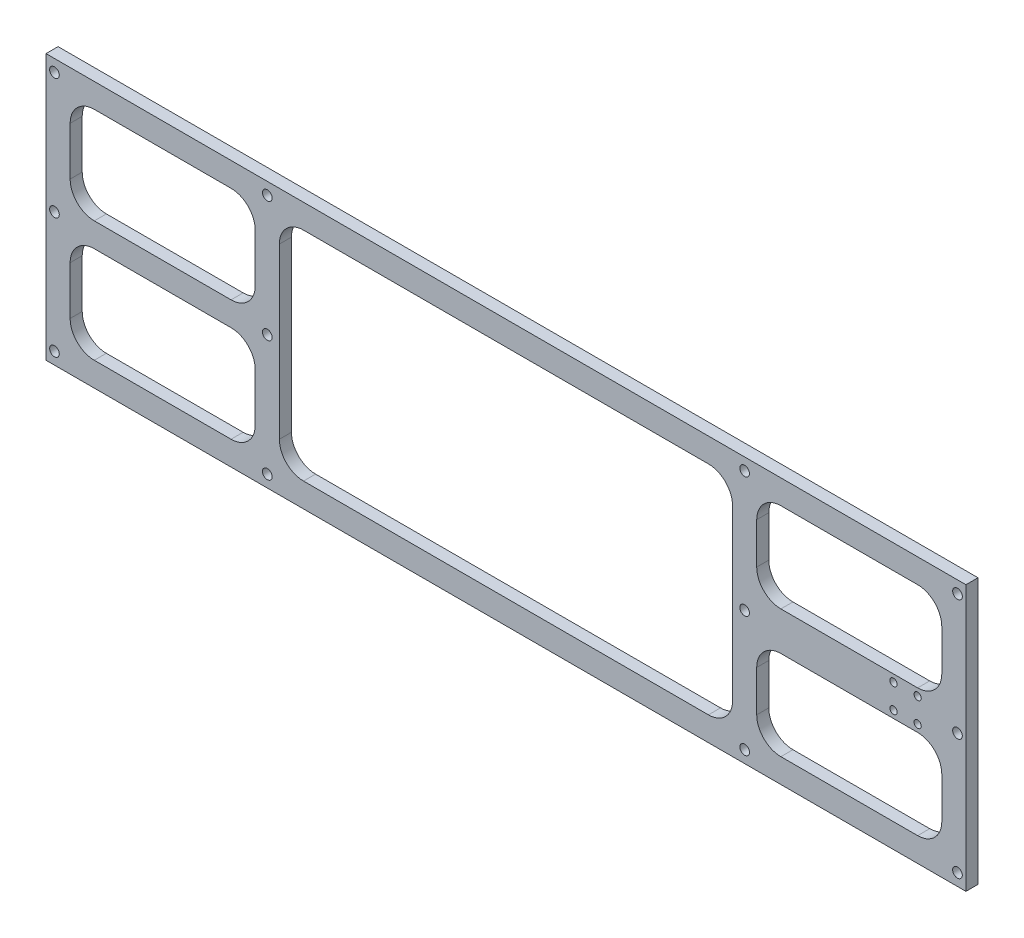
from build123d import *

# Parameters (mm, degrees)
SKETCH_1_W          = 381
SKETCH_1_H          = 110
EXTRUDE_1_DEPTH     = 5
SKETCH_2_R          = 2
CUT_EXTRUDE_1_DEPTH = 5
CUT_EXTRUDE_2_DEPTH = 5
SKETCH_6_R          = 1.5
CUT_EXTRUDE_3_DEPTH = 5
CUT_EXTRUDE_4_DEPTH = 10
FILLET_1_R          = 10


with BuildPart() as part:
    # 草图1 → 凸台-拉伸1 (new body)
    with BuildSketch(Plane.XY):
        with Locations((190.5, 55)):
            Rectangle(SKETCH_1_W, SKETCH_1_H)
    extrude(amount=EXTRUDE_1_DEPTH)

    # 草图2 → 切除-拉伸1 (cut)
    with BuildSketch(Plane.XY.offset(5)):
        with Locations((3.5, 105)):
            Circle(SKETCH_2_R)
        with Locations((3.5, 55)):
            Circle(SKETCH_2_R)
        with Locations((3.5, 5)):
            Circle(SKETCH_2_R)
        with Locations((377.5, 105)):
            Circle(SKETCH_2_R)
        with Locations((377.5, 55)):
            Circle(SKETCH_2_R)
        with Locations((377.5, 5)):
            Circle(SKETCH_2_R)
        with Locations((91.65, 105)):
            Circle(SKETCH_2_R)
        with Locations((91.65, 55)):
            Circle(SKETCH_2_R)
        with Locations((91.65, 5)):
            Circle(SKETCH_2_R)
        with Locations((289.35, 105)):
            Circle(SKETCH_2_R)
        with Locations((289.35, 55)):
            Circle(SKETCH_2_R)
        with Locations((289.35, 5)):
            Circle(SKETCH_2_R)
    extrude(amount=-CUT_EXTRUDE_1_DEPTH, mode=Mode.SUBTRACT)

    # 草图3 → 切除-拉伸2 (cut)
    with BuildSketch(Plane.XY.offset(5)):
        with BuildLine():
            Line((20, 100), (76.65, 100))
            ThreePointArc((76.65, 100), (83.721067812, 97.071067812), (86.65, 90))
            Line((86.65, 90), (86.65, 70))
            ThreePointArc((86.65, 70), (83.721067812, 62.928932188), (76.65, 60))
            Line((76.65, 60), (20, 60))
            ThreePointArc((20, 60), (12.928932188, 62.928932188), (10, 70))
            Line((10, 70), (10, 90))
            ThreePointArc((10, 90), (12.928932188, 97.071067812), (20, 100))
        make_face()
        with BuildLine():
            Line((20, 50), (76.65, 50))
            ThreePointArc((76.65, 50), (83.721067812, 47.071067812), (86.65, 40))
            Line((86.65, 40), (86.65, 20))
            ThreePointArc((86.65, 20), (83.721067812, 12.928932188), (76.65, 10))
            Line((76.65, 10), (20, 10))
            ThreePointArc((20, 10), (12.928932188, 12.928932188), (10, 20))
            Line((10, 20), (10, 40))
            ThreePointArc((10, 40), (12.928932188, 47.071067812), (20, 50))
        make_face()
        with BuildLine():
            Line((106.65, 100), (274.35, 100))
            ThreePointArc((274.35, 100), (281.421067812, 97.071067812), (284.35, 90))
            Line((284.35, 90), (284.35, 70))
            ThreePointArc((284.35, 70), (281.421067812, 62.928932188), (274.35, 60))
            Line((274.35, 60), (106.65, 60))
            ThreePointArc((106.65, 60), (99.578932188, 62.928932188), (96.65, 70))
            Line((96.65, 70), (96.65, 90))
            ThreePointArc((96.65, 90), (99.578932188, 97.071067812), (106.65, 100))
        make_face()
        with BuildLine():
            Line((106.65, 50), (274.35, 50))
            ThreePointArc((274.35, 50), (281.421067812, 47.071067812), (284.35, 40))
            Line((284.35, 40), (284.35, 20))
            ThreePointArc((284.35, 20), (281.421067812, 12.928932188), (274.35, 10))
            Line((274.35, 10), (106.65, 10))
            ThreePointArc((106.65, 10), (99.578932188, 12.928932188), (96.65, 20))
            Line((96.65, 20), (96.65, 40))
            ThreePointArc((96.65, 40), (99.578932188, 47.071067812), (106.65, 50))
        make_face()
        with BuildLine():
            Line((304.35, 100), (361, 100))
            ThreePointArc((361, 100), (368.071067812, 97.071067812), (371, 90))
            Line((371, 90), (371, 73))
            ThreePointArc((371, 73), (368.071067812, 65.928932188), (361, 63))
            Line((361, 63), (304.35, 63))
            ThreePointArc((304.35, 63), (297.278932188, 65.928932188), (294.35, 73))
            Line((294.35, 73), (294.35, 90))
            ThreePointArc((294.35, 90), (297.278932188, 97.071067812), (304.35, 100))
        make_face()
        with BuildLine():
            Line((304.35, 47), (361, 47))
            ThreePointArc((361, 47), (368.071067812, 44.071067812), (371, 37))
            Line((371, 37), (371, 20))
            ThreePointArc((371, 20), (368.071067812, 12.928932188), (361, 10))
            Line((361, 10), (304.35, 10))
            ThreePointArc((304.35, 10), (297.278932188, 12.928932188), (294.35, 20))
            Line((294.35, 20), (294.35, 37))
            ThreePointArc((294.35, 37), (297.278932188, 44.071067812), (304.35, 47))
        make_face()
    extrude(amount=-CUT_EXTRUDE_2_DEPTH, mode=Mode.SUBTRACT)

    # 草图6 → 切除-拉伸3 (cut)
    with BuildSketch(Plane(origin=(0, 0, 0), x_dir=(-1, 0, 0), z_dir=(0, 0, -1))):
        with Locations((-361, 60)):
            Circle(SKETCH_6_R)
        with Locations((-351, 60)):
            Circle(SKETCH_6_R)
        with Locations((-361, 50)):
            Circle(SKETCH_6_R)
        with Locations((-351, 50)):
            Circle(SKETCH_6_R)
    extrude(amount=-CUT_EXTRUDE_3_DEPTH, mode=Mode.SUBTRACT)

    # 草图7 → 切除-拉伸4 (cut)
    with BuildSketch(Plane.XY.offset(5)):
        Polygon((96.65, 90), (96.65, 100), (284.35, 100), (284.35, 10), (96.65, 10), align=None)
    extrude(amount=-CUT_EXTRUDE_4_DEPTH, mode=Mode.SUBTRACT)

    # 圆角1
    fillet_1_edges = [part.edges().sort_by_distance(p)[0] for p in [
        (96.65, 100, 2.5),
        (96.65, 10, 2.5),
        (284.35, 100, 2.5),
        (284.35, 10, 2.5),
    ]]
    fillet(fillet_1_edges, radius=FILLET_1_R)


solid = part.part
